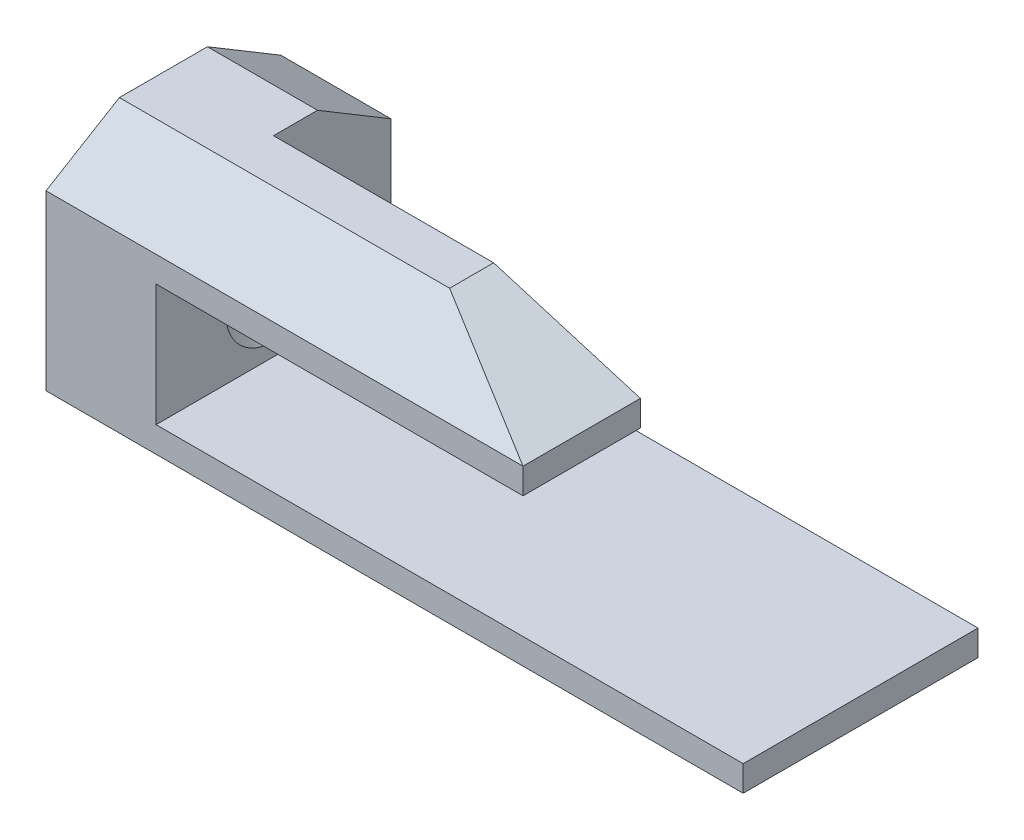
from build123d import *

# Parameters (mm, degrees)
EXTRUDE_1_DEPTH     = 32
CUT_EXTRUDE_2_DEPTH = 3
SKETCH_4_R          = 2.5
CUT_EXTRUDE_3_DEPTH = 15
CHAMFER_2_SIZE      = 4
SKETCH_6_W          = 6
SKETCH_6_H          = 3.5
EXTRUDE_2_DEPTH     = 50
SKETCH_7_W          = 16
SKETCH_7_H          = 6
CUT_EXTRUDE_5_DEPTH = 50
SKETCH_8_W          = 6
SKETCH_8_H          = 3.5
EXTRUDE_3_DEPTH     = 15
SKETCH_9_W          = 15
SKETCH_9_H          = 3.5
EXTRUDE_4_DEPTH     = 6
SKETCH_10_W         = 6
SKETCH_10_H         = 3.5
EXTRUDE_5_DEPTH     = 95
SKETCH_11_W         = 65
SKETCH_11_H         = 10
SKETCH_11_W_2       = 15
CUT_EXTRUDE_6_DEPTH = 2.5
SKETCH_12_W         = 95
SKETCH_12_H         = 10
CUT_EXTRUDE_7_DEPTH = 2.5
EXTRUDE_6_DEPTH     = 95
EXTRUDE_7_DEPTH     = 65
EXTRUDE_8_DEPTH     = 15
CUT_EXTRUDE_START   = -32
CUT_EXTRUDE_9_DEPTH = 32


with BuildPart() as part:
    # Эскиз2 → Бобышка-Вытянуть1 (new body)
    with BuildSketch(Plane.XY):
        Polygon((0, 0), (65, 0), (65, -6), (15, -6), (15, -22.6), (95, -22.6), (95, -28.6), (0, -28.6), align=None)
    extrude(amount=EXTRUDE_1_DEPTH)

    # Эскиз3 → Вырез-Вытянуть2 (cut)
    with BuildSketch(Plane.ZY):
        Polygon((5.393398282, -14.3), (16, -24.906601718), (26.606601718, -14.3), (16, -3.693398282), align=None)
    extrude(amount=-CUT_EXTRUDE_2_DEPTH, mode=Mode.SUBTRACT)

    # Эскиз4 → Вырез-Вытянуть3 (cut)
    with BuildSketch(Plane.ZY):
        with Locations(Location((16, -14.3, 0), (0, 0, 270))):
            Circle(SKETCH_4_R)
    extrude(amount=-CUT_EXTRUDE_3_DEPTH, mode=Mode.SUBTRACT)

    # Фаска2
    chamfer_2_edges = [part.edges().sort_by_distance(p)[0] for p in [
        (15, -11.8, 16),
    ]]
    chamfer(chamfer_2_edges, length=CHAMFER_2_SIZE)

    # Эскиз6 → Бобышка-Вытянуть2 (add)
    with BuildSketch(Plane(origin=(65, 0, 0), x_dir=(0, 0, -1), z_dir=(1, 0, 0))):
        with Locations((-19, 1.75)):
            Rectangle(SKETCH_6_W, SKETCH_6_H)
    extrude(amount=-EXTRUDE_2_DEPTH)

    # Эскиз7 → Вырез-Вытянуть5 (cut)
    with BuildSketch(Plane(origin=(65, 0, 0), x_dir=(0, 0, -1), z_dir=(1, 0, 0))):
        with Locations((-8, -3)):
            Rectangle(SKETCH_7_W, SKETCH_7_H)
    extrude(amount=-CUT_EXTRUDE_5_DEPTH, mode=Mode.SUBTRACT)

    # Эскиз8 → Бобышка-Вытянуть3 (add)
    with BuildSketch(Plane.ZY.offset(-15)):
        with Locations((19, 1.75)):
            Rectangle(SKETCH_8_W, SKETCH_8_H)
    extrude(amount=EXTRUDE_3_DEPTH)

    # Эскиз9 → Бобышка-Вытянуть4 (add)
    with BuildSketch(Plane(origin=(0, 0, 16), x_dir=(-1, 0, 0), z_dir=(0, 0, -1))):
        with Locations((-7.5, 1.75)):
            Rectangle(SKETCH_9_W, SKETCH_9_H)
    extrude(amount=EXTRUDE_4_DEPTH)

    # Эскиз10 → Бобышка-Вытянуть5 (add)
    with BuildSketch(Plane.ZY):
        with Locations((13, -30.35)):
            Rectangle(SKETCH_10_W, SKETCH_10_H)
        with Locations((19, -30.35)):
            Rectangle(SKETCH_10_W, SKETCH_10_H)
    extrude(amount=-EXTRUDE_5_DEPTH)

    # Эскиз11 → Вырез-Вытянуть6 (cut)
    with BuildSketch(Plane(origin=(0, 0, 0), x_dir=(1, 0, 0), z_dir=(0, 1, 0))):
        with Locations((32.5, -27)):
            Rectangle(SKETCH_11_W, SKETCH_11_H)
        with Locations((7.5, -5)):
            Rectangle(SKETCH_11_W_2, SKETCH_11_H)
    extrude(amount=-CUT_EXTRUDE_6_DEPTH, mode=Mode.SUBTRACT)

    # Эскиз12 → Вырез-Вытянуть7 (cut)
    with BuildSketch(Plane.XZ.offset(28.6)):
        with Locations((47.5, 5)):
            Rectangle(SKETCH_12_W, SKETCH_12_H)
        with Locations((47.5, 27)):
            Rectangle(SKETCH_12_W, SKETCH_12_H)
    extrude(amount=-CUT_EXTRUDE_7_DEPTH, mode=Mode.SUBTRACT)

    # Эскиз13 → Бобышка-Вытянуть6 (add)
    with BuildSketch(Plane.ZY):
        Polygon((0, -26.1), (10, -32.1), (10, -26.1), align=None)
        Polygon((22, -26.1), (22, -32.1), (32, -26.1), align=None)
    extrude(amount=-EXTRUDE_6_DEPTH)

    # Эскиз14 → Бобышка-Вытянуть7 (add)
    with BuildSketch(Plane.ZY):
        Polygon((22, 3.5), (32, -2.5), (22, -2.5), align=None)
    extrude(amount=-EXTRUDE_7_DEPTH)

    # Эскиз15 → Бобышка-Вытянуть8 (add)
    with BuildSketch(Plane.ZY):
        Polygon((10, 3.5), (10, -2.5), (0, -2.5), align=None)
    extrude(amount=-EXTRUDE_8_DEPTH)

    # Эскиз16 → Вырез-Вытянуть9 (cut)
    with BuildSketch(Plane.XY.offset(32).offset(CUT_EXTRUDE_START)):
        Polygon((65, -2.5), (65, 3.5), (45, 3.5), align=None)
        Polygon((95, -26.1), (95, -32.1), (75, -32.1), align=None)
    extrude(amount=CUT_EXTRUDE_9_DEPTH, mode=Mode.SUBTRACT)


solid = part.part
